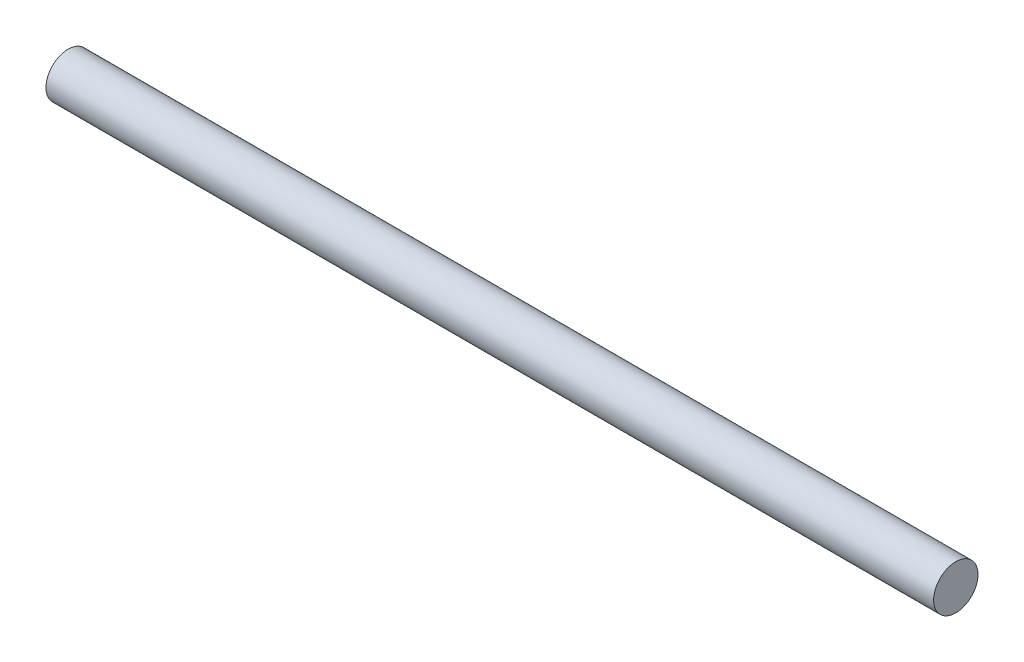
from build123d import *

# Parameters (mm, degrees)
SKETCH1_R           = 6.35
BOSS_EXTRUDE1_DEPTH = 254


with BuildPart() as part:
    # Sketch1 → Boss-Extrude1 (new body)
    with BuildSketch(Plane.YZ):
        with Locations(Location((-2.704331094, 2.58502237, 0), (0, 0, 270))):
            Circle(SKETCH1_R)
    extrude(amount=BOSS_EXTRUDE1_DEPTH)


solid = part.part
